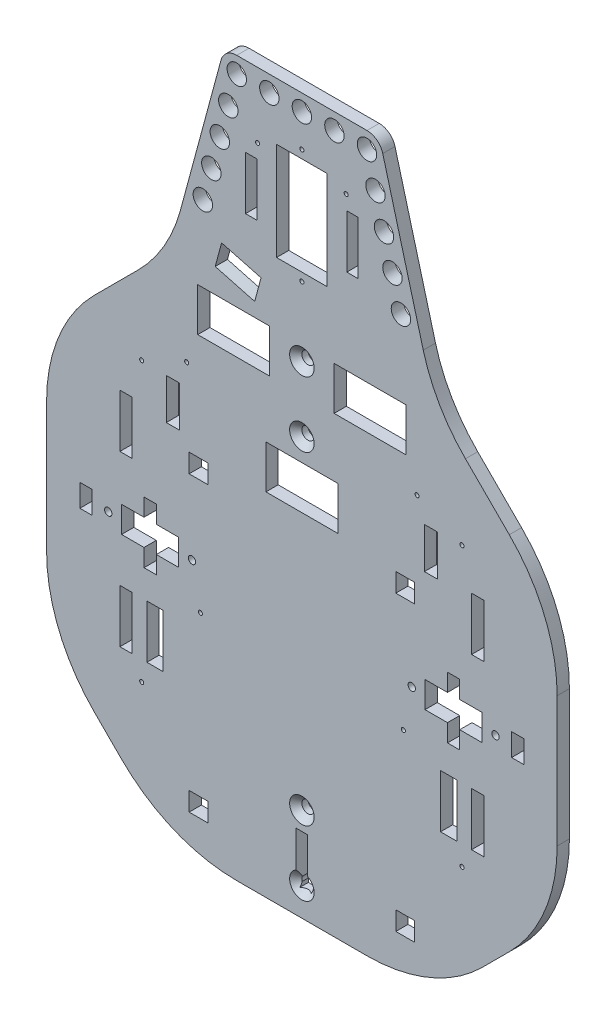
from build123d import *

# Parameters (mm, degrees)
SKICA1_R                 = 0.5
SKICA1_R_2               = 2.375
SKICA1_R_3               = 0.9
SKICA1_W                 = 3
SKICA1_H                 = 13
SKICA1_H_2               = 5.5
SKICA1_W_2               = 17.6
SKICA1_H_3               = 10.6
SKICA1_W_3               = 12.4
SKICA1_H_4               = 24
SKICA1_W_4               = 2.8
SKICA1_W_5               = 3.2
SKICA1_H_5               = 10
SKICA1_W_6               = 4.6
SKICA1_H_6               = 4.6
P_IDAT_VYSUNUT_M1_DEPTH  = 3
SKICA2_R                 = 1.5
ODEBRAT_VYSUNUT_M1_DEPTH = 3
ZKOSEN_1_SIZE            = 1.5
ZAOBLIT1_R               = 40
ZAOBLIT2_R               = 4
SKICA3_R                 = 0.5
SKICA3_W                 = 2.8
SKICA3_H                 = 13
ODEBRAT_VYSUNUT_M2_DEPTH = 129.730338305
SKICA12_R                = 0.5
ODEBRAT_VYSUNUT_M3_DEPTH = 10
SKICA14_R                = 0.5
ODEBRAT_VYSUNUT_M5_DEPTH = 10
SKICA13_W                = 4
SKICA13_H                = 13
ODEBRAT_VYSUNUT_M6_DEPTH = 10


with BuildPart() as part:
    # Skica1 → Přidat vysunutím1 (new body)
    with BuildSketch(Plane.XY):
        Polygon((-62.5, -32.5), (-62.5, 32.5), (-32.5, 62.5), (-19.003438856, 112.5), (19.003438856, 112.5), (32.5, 62.5), (62.5, 32.5), (62.5, -32.5), (32.5, -62.5), (-32.5, -62.5), align=None)
        with Locations((0, 100.5)):
            Circle(SKICA1_R, mode=Mode.SUBTRACT)
        with Locations(Location((0, 72.5, 0), (0, 0, 180))):
            Circle(SKICA1_R, mode=Mode.SUBTRACT)
        with Locations((0, 108.5)):
            Circle(SKICA1_R_2, mode=Mode.SUBTRACT)
        with Locations((7.97, 108.5)):
            Circle(SKICA1_R_2, mode=Mode.SUBTRACT)
        with Locations((15.94, 108.5)):
            Circle(SKICA1_R_2, mode=Mode.SUBTRACT)
        with Locations(Location((-15.94, 108.5, 0), (0, 0, 180))):
            Circle(SKICA1_R_2, mode=Mode.SUBTRACT)
        with Locations(Location((-7.97, 108.5, 0), (0, 0, 180))):
            Circle(SKICA1_R_2, mode=Mode.SUBTRACT)
        with Locations(Location((-18.017013584, 100.805397049, 0), (0, 0, 180))):
            Circle(SKICA1_R_2, mode=Mode.SUBTRACT)
        with Locations((-20.094027168, 93.110794098)):
            Circle(SKICA1_R_2, mode=Mode.SUBTRACT)
        with Locations((-22.171040752, 85.416191147)):
            Circle(SKICA1_R_2, mode=Mode.SUBTRACT)
        with Locations((-24.248054336, 77.721588196)):
            Circle(SKICA1_R_2, mode=Mode.SUBTRACT)
        with Locations(Location((24.248054336, 77.721588196, 0), (0, 0, 180))):
            Circle(SKICA1_R_2, mode=Mode.SUBTRACT)
        with Locations(Location((22.171040752, 85.416191147, 0), (0, 0, 180))):
            Circle(SKICA1_R_2, mode=Mode.SUBTRACT)
        with Locations(Location((20.094027168, 93.110794098, 0), (0, 0, 180))):
            Circle(SKICA1_R_2, mode=Mode.SUBTRACT)
        with Locations((18.017013584, 100.805397049)):
            Circle(SKICA1_R_2, mode=Mode.SUBTRACT)
        with Locations((47.397781356, 0)):
            Circle(SKICA1_R_3, mode=Mode.SUBTRACT)
        with Locations(Location((26.897781356, 0, 0), (0, 0, 180))):
            Circle(SKICA1_R_3, mode=Mode.SUBTRACT)
        with Locations(Location((-47.397781356, 0, 0), (0, 0, 180))):
            Circle(SKICA1_R_3, mode=Mode.SUBTRACT)
        with Locations((-26.897781356, 0)):
            Circle(SKICA1_R_3, mode=Mode.SUBTRACT)
        Polygon((-44.147781356, 3.2), (-38.647781356, 3.2), (-38.647781356, 7.5), (-35.647781356, 7.5), (-35.647781356, 3.2), (-30.147781356, 3.2), (-30.147781356, -3.2), (-35.647781356, -3.2), (-35.647781356, -7.5), (-38.647781356, -7.5), (-38.647781356, -3.2), (-44.147781356, -3.2), align=None, mode=Mode.SUBTRACT)
        with Locations((-43.047781356, 20.7)):
            Rectangle(SKICA1_W, SKICA1_H, mode=Mode.SUBTRACT)
        with Locations((-52.847781356, 0)):
            Rectangle(SKICA1_W, SKICA1_H_2, mode=Mode.SUBTRACT)
        with Locations((-43.047781356, -20.7)):
            Rectangle(SKICA1_W, SKICA1_H, mode=Mode.SUBTRACT)
        Polygon((38.647781356, -7.5), (35.647781356, -7.5), (35.647781356, -3.2), (30.147781356, -3.2), (30.147781356, 3.2), (35.647781356, 3.2), (35.647781356, 7.5), (38.647781356, 7.5), (38.647781356, 3.2), (44.147781356, 3.2), (44.147781356, -3.2), (38.647781356, -3.2), align=None, mode=Mode.SUBTRACT)
        with Locations((52.847781356, 0)):
            Rectangle(SKICA1_W, SKICA1_H_2, mode=Mode.SUBTRACT)
        with Locations((43.047781356, 20.7)):
            Rectangle(SKICA1_W, SKICA1_H, mode=Mode.SUBTRACT)
        with Locations((43.047781356, -20.7)):
            Rectangle(SKICA1_W, SKICA1_H, mode=Mode.SUBTRACT)
        with Locations((16.7, 53.8)):
            Rectangle(SKICA1_W_2, SKICA1_H_3, mode=Mode.SUBTRACT)
        with Locations((0, 28.8)):
            Rectangle(SKICA1_W_2, SKICA1_H_3, mode=Mode.SUBTRACT)
        with Locations((-16.7, 53.8)):
            Rectangle(SKICA1_W_2, SKICA1_H_3, mode=Mode.SUBTRACT)
        with Locations((0, 86.5)):
            Rectangle(SKICA1_W_3, SKICA1_H_4, mode=Mode.SUBTRACT)
        with Locations((-12.4, 86.5)):
            Rectangle(SKICA1_W_4, SKICA1_H, mode=Mode.SUBTRACT)
        Polygon((-21.212172534, 65.088190451), (-11.552914271, 62.5), (-10, 68.295554958), (-19.659258263, 70.883745409), align=None, mode=Mode.SUBTRACT)
        with Locations((12.4, 86.5)):
            Rectangle(SKICA1_W_4, SKICA1_H, mode=Mode.SUBTRACT)
        with Locations((31.6, 31)):
            Rectangle(SKICA1_W_5, SKICA1_H_5, mode=Mode.SUBTRACT)
        with Locations((-31.6, 31)):
            Rectangle(SKICA1_W_5, SKICA1_H_5, mode=Mode.SUBTRACT)
        with Locations((25.3, 20.23)):
            Rectangle(SKICA1_W_6, SKICA1_H_6, mode=Mode.SUBTRACT)
        with Locations((25.3, -51.5)):
            Rectangle(SKICA1_W_6, SKICA1_H_6, mode=Mode.SUBTRACT)
        with Locations((-25.3, -51.5)):
            Rectangle(SKICA1_W_6, SKICA1_H_6, mode=Mode.SUBTRACT)
        with Locations((-25.3, 20.23)):
            Rectangle(SKICA1_W_6, SKICA1_H_6, mode=Mode.SUBTRACT)
    extrude(amount=P_IDAT_VYSUNUT_M1_DEPTH)

    # Skica2 → Odebrat vysunutím1 (cut)
    with BuildSketch(Plane.XY):
        with Locations(Location((0, 39.6, 0), (0, 0, 180))):
            Circle(SKICA2_R)
        with Locations(Location((0, 55.6, 0), (0, 0, 180))):
            Circle(SKICA2_R)
        with Locations(Location((0, -55.6, 0), (0, 0, 180))):
            Circle(SKICA2_R)
        with Locations(Location((0, -39.6, 0), (0, 0, 180))):
            Circle(SKICA2_R)
    extrude(amount=ODEBRAT_VYSUNUT_M1_DEPTH, mode=Mode.SUBTRACT)

    # Zkosení1
    zkosen_1_edges = [part.edges().sort_by_distance(p)[0] for p in [
        (1.5, 55.6, 3),
        (1.5, -55.6, 3),
        (1.5, -39.6, 3),
        (1.5, 39.6, 3),
    ]]
    chamfer(zkosen_1_edges, length=ZKOSEN_1_SIZE)

    # Zaoblit1
    zaoblit1_edges = [part.edges().sort_by_distance(p)[0] for p in [
        (-62.5, -32.5, 1.5),
        (-62.5, 32.5, 1.5),
        (-32.5, 62.5, 1.5),
        (32.5, 62.5, 1.5),
        (62.5, 32.5, 1.5),
        (62.5, -32.5, 1.5),
        (32.5, -62.5, 1.5),
        (-32.5, -62.5, 1.5),
    ]]
    fillet(zaoblit1_edges, radius=ZAOBLIT1_R)

    # Zaoblit2
    zaoblit2_edges = [part.edges().sort_by_distance(p)[0] for p in [
        (-19.003438856, 112.5, 1.5),
        (19.003438856, 112.5, 1.5),
    ]]
    fillet(zaoblit2_edges, radius=ZAOBLIT2_R)

    # Skica3 → Odebrat vysunutím2 (cut, through all)
    with BuildSketch(Plane.XY.offset(3)):
        with Locations((-28.2, 41.3)):
            Circle(SKICA3_R)
        with Locations(Location((28.2, 41.3, 0), (0, 0, 180))):
            Circle(SKICA3_R)
        with Locations((0, -50.6)):
            Rectangle(SKICA3_W, SKICA3_H)
    extrude(amount=-ODEBRAT_VYSUNUT_M2_DEPTH, mode=Mode.SUBTRACT)

    # Skica12 → Odebrat vysunutím3 (cut)
    with BuildSketch(Plane.XY.offset(3)):
        with Locations((10.848403532, 96.463495388)):
            Circle(SKICA12_R)
        with Locations((39.214203331, 36.203210824)):
            Circle(SKICA12_R)
        with Locations((39.214203331, -31.992998607)):
            Circle(SKICA12_R)
        with Locations((24.842590046, -10.159715514)):
            Circle(SKICA12_R)
        with Locations(Location((-39.214203331, -31.992998607, 0), (0, 0, 180))):
            Circle(SKICA12_R)
        with Locations(Location((-39.214203331, 36.203210824, 0), (0, 0, 180))):
            Circle(SKICA12_R)
    extrude(amount=-ODEBRAT_VYSUNUT_M3_DEPTH, mode=Mode.SUBTRACT)

    # Skica14 → Odebrat vysunutím5 (cut)
    with BuildSketch(Plane.XY.offset(3)):
        with Locations((-10.848403532, 96.463495388)):
            Circle(SKICA14_R)
        with Locations((-24.842590046, -10.159715514)):
            Circle(SKICA14_R)
    extrude(amount=-ODEBRAT_VYSUNUT_M5_DEPTH, mode=Mode.SUBTRACT)

    # Skica13 → Odebrat vysunutím6 (cut)
    with BuildSketch(Plane.XY.offset(3)):
        with Locations((35.943945392, -20.7)):
            Rectangle(SKICA13_W, SKICA13_H)
        with Locations((-35.943945392, -20.7)):
            Rectangle(SKICA13_W, SKICA13_H)
    extrude(amount=-ODEBRAT_VYSUNUT_M6_DEPTH, mode=Mode.SUBTRACT)


solid = part.part
